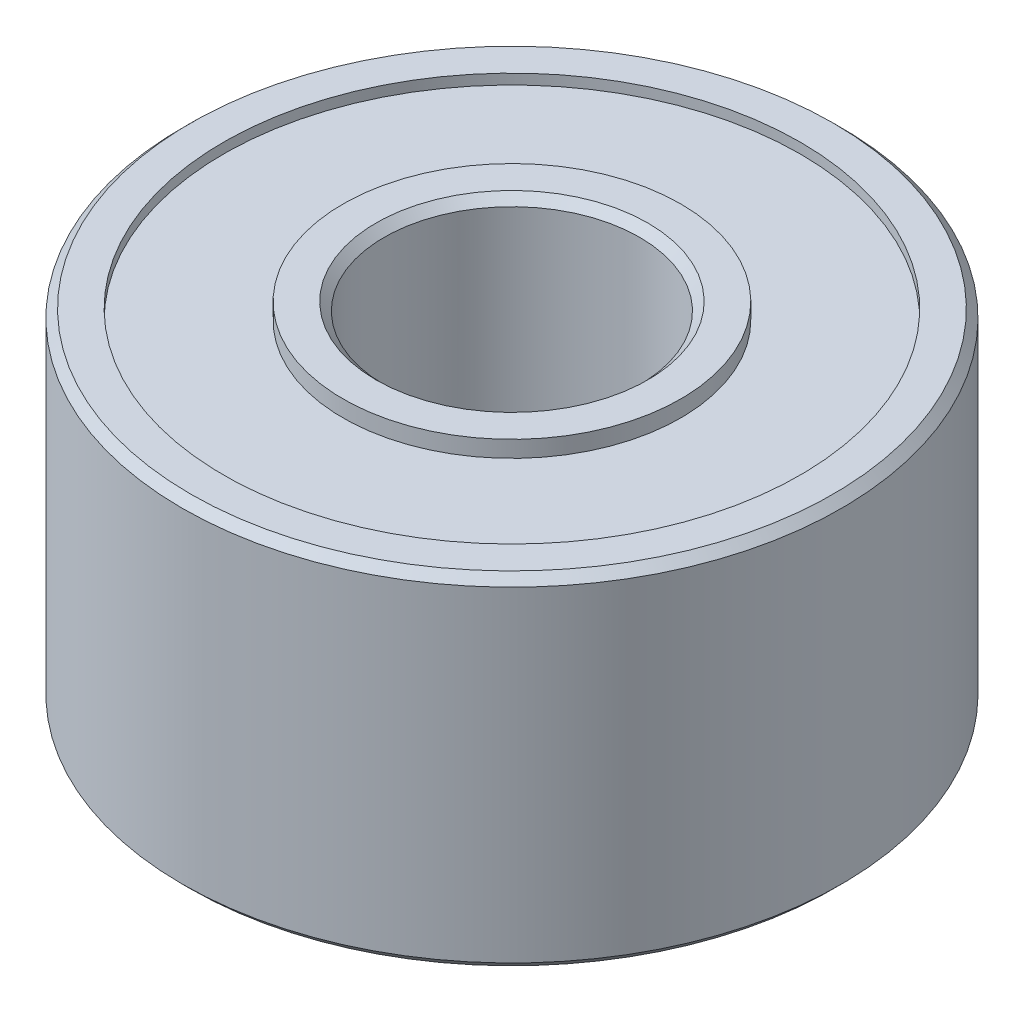
from build123d import *

# Parameters (mm, degrees)
CHAMFER1_SIZE = 0.1


with BuildPart() as part:
    # Sketch2 → Revolve1 (revolve)
    with BuildSketch(Plane.XY, mode=Mode.PRIVATE) as revolve1_sk:
        Polygon((1.55, 2.15), (1.55, -2.15), (2.05, -2.15), (2.05, -1.95), (3.5, -1.95), (3.5, -2.075), (4, -2.075), (4, 2.075), (3.5, 2.075), (3.5, 1.95), (2.05, 1.95), (2.05, 2.15), align=None)
    revolve(revolve1_sk.sketch.rotate(Axis((0, -2, 0), (0, 1, 0)), 90), axis=Axis((0, -2, 0), (0, 1, 0)))

    # Chamfer1
    chamfer1_edges = [part.edges().sort_by_distance(p)[0] for p in [
        (0, -2.15, 1.55),
        (0, 2.15, 1.55),
        (0, 2.075, 4),
        (0, -2.075, 4),
    ]]
    chamfer(chamfer1_edges, length=CHAMFER1_SIZE)


solid = part.part
